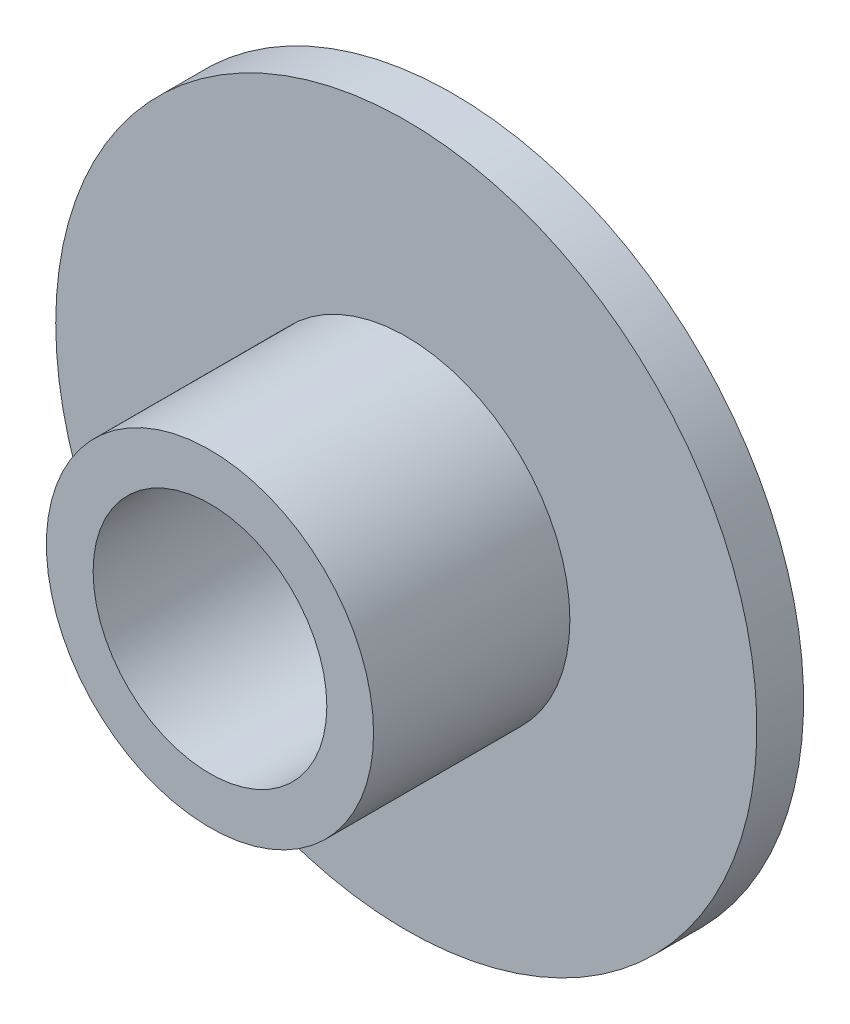
from build123d import *
from build123d.topology import SkipClean

# Parameters (mm, degrees)
SKETCH_1_R      = 3.5
SKETCH_1_R_2    = 2.5
EXTRUDE_1_DEPTH = 4.2
EXTRUDE_START   = 1
SKETCH_2_R      = 7.5
SKETCH_2_R_2    = 2.5
EXTRUDE_2_DEPTH = 1


with BuildPart() as part:
    # 草圖1 → 填料-伸長1 (new body)
    with BuildSketch(Plane.XY):
        Circle(SKETCH_1_R)
        Circle(SKETCH_1_R_2, mode=Mode.SUBTRACT)
    extrude(amount=EXTRUDE_1_DEPTH)

    # 草圖2 → 填料-伸長2 (add)
    with SkipClean():  # the faces are left unmerged after this step: merging them gives an invalid solid
        with BuildSketch(Plane(origin=(0, 0, 0), x_dir=(-1, 0, 0), z_dir=(0, 0, -1)).offset(EXTRUDE_START)):
            Circle(SKETCH_2_R)
            Circle(SKETCH_2_R_2, mode=Mode.SUBTRACT)
        extrude(amount=-EXTRUDE_2_DEPTH)


solid = part.part
